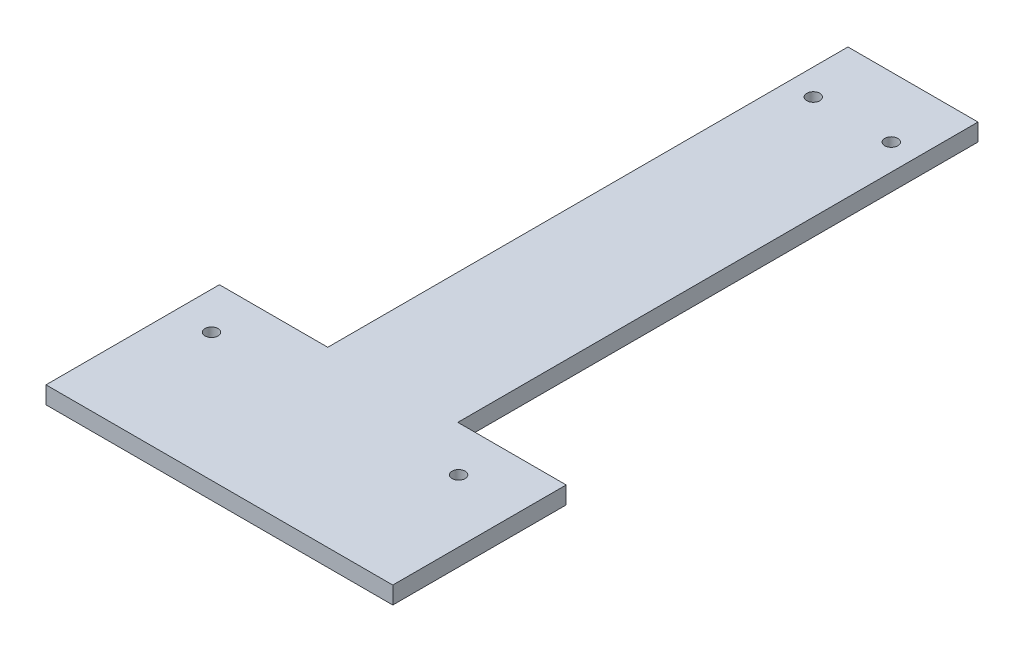
from build123d import *

# Parameters (mm, degrees)
SKETCH1_W           = 15
SKETCH1_H           = 2
BOSS_EXTRUDE1_DEPTH = 80
SKETCH2_W           = 40
SKETCH2_H           = 20
BOSS_EXTRUDE2_DEPTH = 2
SKETCH3_R           = 0.75
CUT_EXTRUDE1_DEPTH  = 85.618260441


with BuildPart() as part:
    # Sketch1 → Boss-Extrude1 (new body)
    with BuildSketch(Plane.XY):
        with Locations((7.5, 1)):
            Rectangle(SKETCH1_W, SKETCH1_H)
    extrude(amount=BOSS_EXTRUDE1_DEPTH)

    # Sketch2 → Boss-Extrude2 (add)
    with BuildSketch(Plane(origin=(0, 2, 0), x_dir=(1, 0, 0), z_dir=(0, 1, 0))):
        with Locations((7.5, -70)):
            Rectangle(SKETCH2_W, SKETCH2_H)
    extrude(amount=-BOSS_EXTRUDE2_DEPTH)

    # Sketch3 → Cut-Extrude1 (cut, through all)
    with BuildSketch(Plane(origin=(0, 2, 0), x_dir=(1, 0, 0), z_dir=(0, 1, 0))):
        with Locations(Location((20.291432582, -65.2, 0), (0, 0, 180))):
            Circle(SKETCH3_R)
        with Locations(Location((-8.208567418, -65.2, 0), (0, 0, 180))):
            Circle(SKETCH3_R)
        with Locations(Location((12, -7, 0), (0, 0, 180))):
            Circle(SKETCH3_R)
        with Locations(Location((3, -7, 0), (0, 0, 180))):
            Circle(SKETCH3_R)
    extrude(amount=-CUT_EXTRUDE1_DEPTH, mode=Mode.SUBTRACT)


solid = part.part
